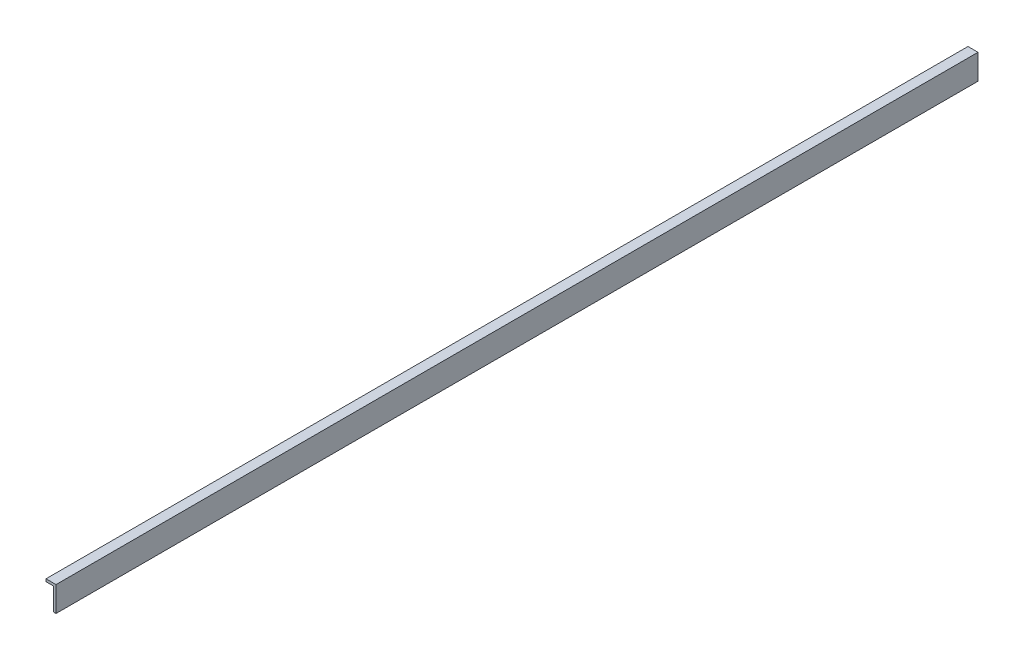
from build123d import *

# Parameters (mm, degrees)
STORE_KASET_L_RAF_3_SAG_1_START = -20
STORE_KASET_L_RAF_3_SAG_1_DEPTH = 735.5


with BuildPart() as part:
    # Sketch1 → STORE_kaset_L_raf_3_sag_1 (new body)
    with BuildSketch(Plane.XY.offset(STORE_KASET_L_RAF_3_SAG_1_START)):
        Polygon((501.5, 404.5), (503.5, 404.5), (503.5, 424.5), (495.5, 424.5), (495.5, 422.5), (501.5, 422.5), align=None)
    extrude(amount=-STORE_KASET_L_RAF_3_SAG_1_DEPTH)


solid = part.part
